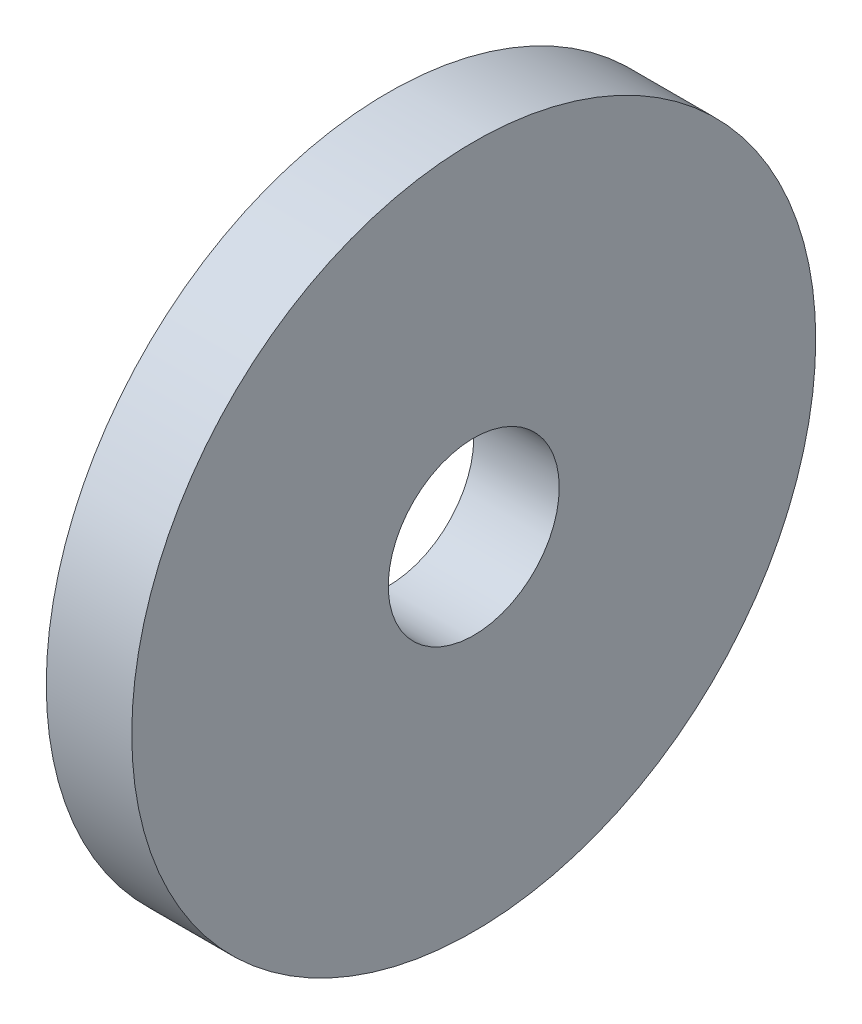
from build123d import *

# Parameters (mm, degrees)
SKETCH1_R           = 12.7
SKETCH1_R_2         = 3.175
BOSS_EXTRUDE1_DEPTH = 3.175


with BuildPart() as part:
    # Sketch1 → Boss-Extrude1 (new body)
    with BuildSketch(Plane(origin=(0, 0, 0), x_dir=(0, 0, -1), z_dir=(1, 0, 0))):
        Circle(SKETCH1_R)
        Circle(SKETCH1_R_2, mode=Mode.SUBTRACT)
    extrude(amount=BOSS_EXTRUDE1_DEPTH)


solid = part.part
